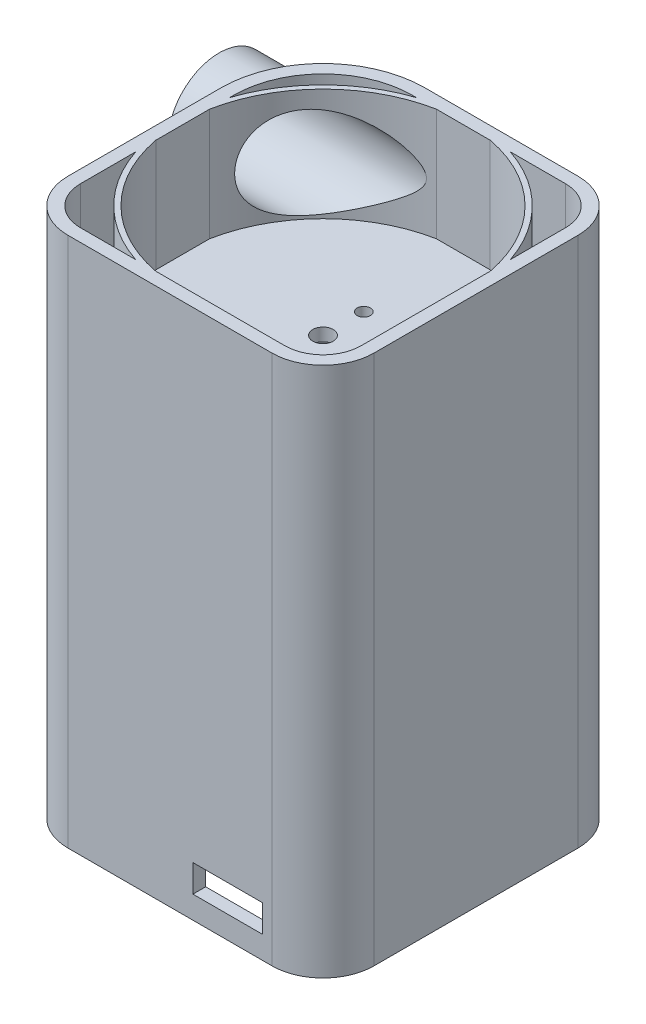
from build123d import *
from build123d.topology import SkipClean

# Parameters (mm, degrees)
BOSS_EXTRUDE1_DEPTH  = 82
SHELL1_T             = -2.5
BOSS_EXTRUDE2_DEPTH  = 22
SHELL2_T             = -2.5
BOSS_EXTRUDE7_DEPTH  = 22
SKETCH7_R            = 2
SKETCH7_R_2          = 1.3
CUT_EXTRUDE1_DEPTH   = 10
SKETCH8_R            = 16
SKETCH8_R_2          = 15.2
BOSS_EXTRUDE8_DEPTH  = 6
SKETCH10_R           = 10
SKETCH10_R_2         = 9
BOSS_EXTRUDE9_DEPTH  = 30
SKETCH13_R           = 9
CUT_EXTRUDE2_DEPTH   = 40
CUT_EXTRUDE3_START   = -22
CUT_EXTRUDE3_DEPTH   = 22
BOSS_EXTRUDE10_DEPTH = 40
SKETCH16_W           = 13.658631977
SKETCH16_H           = 5.363360903
CUT_EXTRUDE4_DEPTH   = 10


with BuildPart() as part:
    # Sketch2 → Boss-Extrude1 (new body)
    with BuildSketch(Plane(origin=(0, 0, 0), x_dir=(1, 0, 0), z_dir=(0, 1, 0))):
        with BuildLine():
            Line((-10, 30), (20, 30))
            ThreePointArc((20, 30), (27.071067812, 27.071067812), (30, 20))
            Line((30, 20), (30, -20))
            ThreePointArc((30, -20), (27.071067812, -27.071067812), (20, -30))
            Line((20, -30), (-20, -30))
            ThreePointArc((-20, -30), (-27.071067812, -27.071067812), (-30, -20))
            Line((-30, -20), (-30, 10))
            ThreePointArc((-30, 10), (-24.142135624, 24.142135624), (-10, 30))
        make_face()
    extrude(amount=BOSS_EXTRUDE1_DEPTH)

    # Shell1
    shell1_openings = [part.faces().sort_by_distance(p)[0] for p in [
        (0.462600785, 0, 0.462600785),
    ]]
    offset(amount=SHELL1_T, openings=shell1_openings, kind=Kind.INTERSECTION)

    # Sketch5 → Boss-Extrude2 (add)
    with BuildSketch(Plane(origin=(0, 82, 0), x_dir=(1, 0, 0), z_dir=(0, 1, 0))):
        with BuildLine():
            Line((-30, 10), (-30, -20))
            ThreePointArc((-30, -20), (-27.071067812, -27.071067812), (-20, -30))
            Line((-20, -30), (20, -30))
            ThreePointArc((20, -30), (27.071067812, -27.071067812), (30, -20))
            Line((30, -20), (30, 20))
            ThreePointArc((30, 20), (27.071067812, 27.071067812), (20, 30))
            Line((20, 30), (-10, 30))
            ThreePointArc((-10, 30), (-24.142135624, 24.142135624), (-30, 10))
        make_face()
    extrude(amount=BOSS_EXTRUDE2_DEPTH)

    # Shell2
    shell2_openings = [part.faces().sort_by_distance(p)[0] for p in [
        (0.462600785, 104, 0.462600785),
    ]]
    offset(amount=SHELL2_T, openings=shell2_openings, kind=Kind.INTERSECTION)

    # Sketch6 → Boss-Extrude7 (add)
    with BuildSketch(Plane(origin=(0, 82, 0), x_dir=(1, 0, 0), z_dir=(0, 1, 0))):
        with BuildLine():
            Line((-0.723225176, -28.990980414), (-0.698286377, -27.991291434))
            ThreePointArc((-0.698286377, -27.991291434), (-19.550549627, 20.044351056), (28, 0))
            Line((28, 0), (29, 0))
            ThreePointArc((29, 0), (-20.248783543, 20.760220737), (-0.723225176, -28.990980414))
        make_face()
    extrude(amount=BOSS_EXTRUDE7_DEPTH)

    # Sketch7 → Cut-Extrude1 (cut)
    with BuildSketch(Plane(origin=(0, 82, 0), x_dir=(1, 0, 0), z_dir=(0, 1, 0))):
        with Locations(Location((0, 0, 0), (0, 0, 270))):
            Circle(SKETCH7_R)
        with Locations(Location((0, 8, 0), (0, 0, 270))):
            Circle(SKETCH7_R_2)
        with Locations(Location((0, -8, 0), (0, 0, 270))):
            Circle(SKETCH7_R_2)
    extrude(amount=-CUT_EXTRUDE1_DEPTH, mode=Mode.SUBTRACT)

    # Sketch8 → Boss-Extrude8 (add)
    with BuildSketch(Plane.XZ.offset(-79.5)):
        with Locations(Location((0, 0, 0), (0, 0, 90))):
            Circle(SKETCH8_R)
        with Locations(Location((0, 0, 0), (0, 0, 270))):
            Circle(SKETCH8_R_2, mode=Mode.SUBTRACT)
    extrude(amount=BOSS_EXTRUDE8_DEPTH)

    # Sketch10 → Boss-Extrude9 (add)
    with BuildSketch(Plane.ZY.offset(38.5)):
        with Locations((-18.144716291, 91.6227209)):
            Circle(SKETCH10_R)
        with Locations((-18.144716291, 91.6227209)):
            Circle(SKETCH10_R_2, mode=Mode.SUBTRACT)
    extrude(amount=-BOSS_EXTRUDE9_DEPTH)

    # Sketch13 → Cut-Extrude2 (cut)
    with SkipClean():  # the faces are left unmerged after this step: merging them gives an invalid solid
        with BuildSketch(Plane.ZY.offset(38.5)):
            with Locations((-18.144716291, 91.6227209)):
                Circle(SKETCH13_R)
        extrude(amount=-CUT_EXTRUDE2_DEPTH, mode=Mode.SUBTRACT)

    # Sketch14 → Cut-Extrude3 (cut)
    with BuildSketch(Plane(origin=(0, 104, 0), x_dir=(1, 0, 0), z_dir=(0, 1, 0)).offset(CUT_EXTRUDE3_START)):
        with BuildLine():
            Line((-27.5, 5.267826876), (-27.5, -5.267826876))
            ThreePointArc((-27.5, -5.267826876), (-19.798989873, -19.798989873), (-5.267826876, -27.5))
            Line((-5.267826876, -27.5), (20, -27.5))
            ThreePointArc((20, -27.5), (25.303300859, -25.303300859), (27.5, -20))
            Line((27.5, -20), (27.5, 5.267826876))
            ThreePointArc((27.5, 5.267826876), (19.798989873, 19.798989873), (5.267826876, 27.5))
            Line((5.267826876, 27.5), (-5.267826876, 27.5))
            ThreePointArc((-5.267826876, 27.5), (-19.798989873, 19.798989873), (-27.5, 5.267826876))
        make_face()
    extrude(amount=CUT_EXTRUDE3_DEPTH, mode=Mode.SUBTRACT)

    # Sketch15 → Boss-Extrude10 (add)
    with BuildSketch(Plane.XZ.offset(-79.5)):
        with BuildLine():
            ThreePointArc((3.703635336, -21.393366311), (0.847507366, -19.311262287), (-2.008620603, -21.393366311))
            add(Edge.make_bspline(
                [(-2.008620603, -21.393366311), (-16.308586663, -22.311262287), (-2.008620603, -23.229158263)],
                knots=[5.132671367, 5.132671367, 5.132671367, 7.433699247, 7.433699247, 7.433699247], degree=2, weights=[1, 0.408018281, 1]))
            ThreePointArc((-2.008620603, -23.229158263), (0.847507366, -25.311262287), (3.703635336, -23.229158263))
            add(Edge.make_bspline(
                [(3.703635336, -23.229158263), (18.003601395, -22.311262287), (3.703635336, -21.393366311)],
                knots=[1.991078714, 1.991078714, 1.991078714, 4.292106593, 4.292106593, 4.292106593], degree=2, weights=[1, 0.408018281, 1]))
        make_face()
    extrude(amount=BOSS_EXTRUDE10_DEPTH)

    # Sketch16 → Cut-Extrude4 (cut)
    with BuildSketch(Plane.XY.offset(30)):
        with Locations((11.343210565, 7.109274004)):
            Rectangle(SKETCH16_W, SKETCH16_H)
    extrude(amount=-CUT_EXTRUDE4_DEPTH, mode=Mode.SUBTRACT)


solid = part.part
